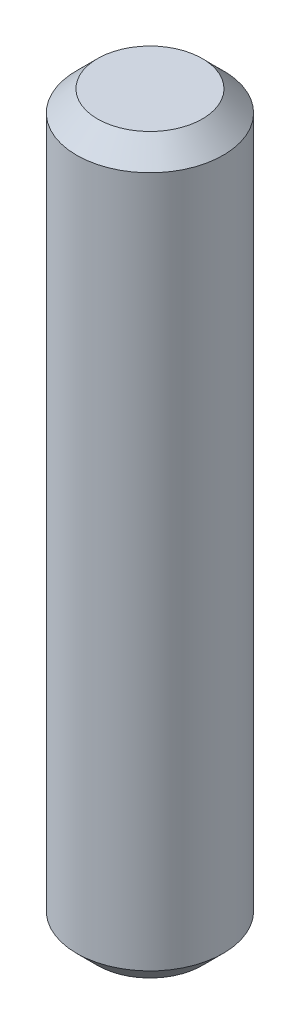
from build123d import *

# Parameters (mm, degrees)
SKETCH1_R           = 7
BOSS_EXTRUDE1_DEPTH = 70
CHAMFER1_SIZE       = 2


with BuildPart() as part:
    # Sketch1 → Boss-Extrude1 (new body)
    with BuildSketch(Plane(origin=(0, 0, 0), x_dir=(1, 0, 0), z_dir=(0, 1, 0))):
        with Locations(Location((0, 0, 0), (0, 0, 270))):
            Circle(SKETCH1_R)
    extrude(amount=BOSS_EXTRUDE1_DEPTH)

    # Chamfer1
    chamfer1_edges = [part.edges().sort_by_distance(p)[0] for p in [
        (0, 0, -7),
        (0, 70, -7),
    ]]
    chamfer(chamfer1_edges, length=CHAMFER1_SIZE)


solid = part.part
